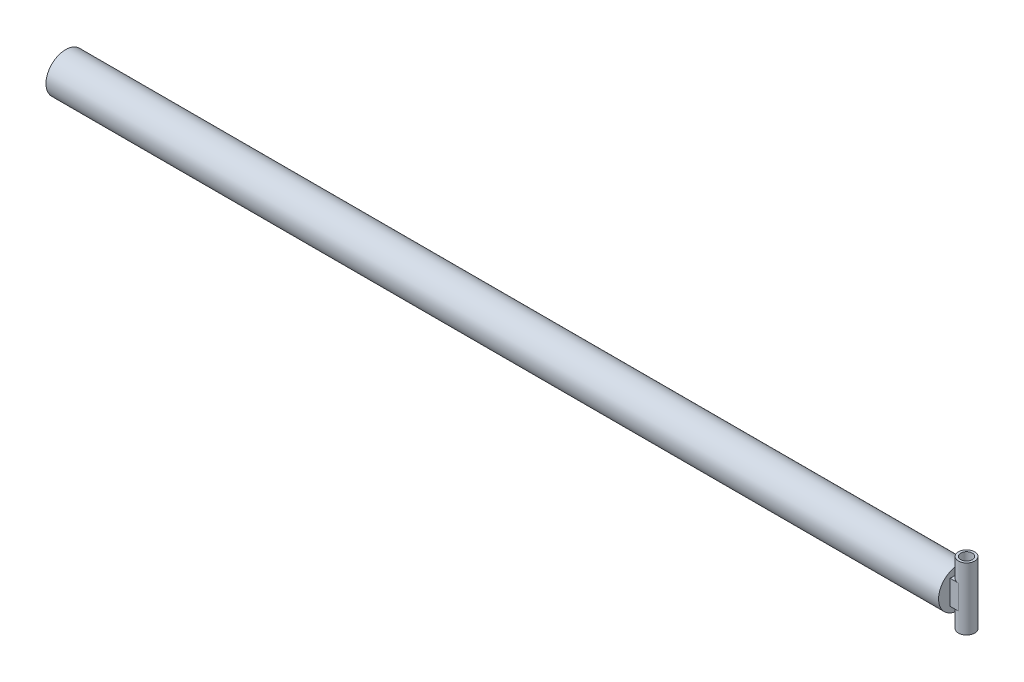
from build123d import *

# Parameters (mm, degrees)
CILINDAR_SHELL1_T                 = -10
CILINDAR_SKETCH3_W                = 30
CILINDAR_SKETCH3_H                = 10
CILINDAR_BOSS_EXTRUDE1_DEPTH      = 135
CILINDAR_BOSS_EXTRUDE1_DEPTH_BACK = 135
CILINDAR_SKETCH2_R                = 35
CILINDAR_SKETCH2_R_2              = 25
CILINDAR_BOSS_EXTRUDE7_REACH      = 3865.295
CILINDAR_SKETCH6_W                = 70
CILINDAR_SKETCH6_H                = 105
CILINDAR_SKETCH7_R                = 65
CILINDAR_SKETCH7_R_2              = 18.75
CILINDAR_BOSS_EXTRUDE8_DEPTH      = 10


with BuildPart() as part:
    # cilindar_Sketch1 → cilindar_Revolve1 (revolve)
    with BuildSketch(Plane(origin=(0, 0, 0), x_dir=(1, 0, 0), z_dir=(0, 1, 0))):
        Polygon((-1930, 75), (-1930, 0), (1930, 0), (1930, 75), (1900, 75), (1900, 85), (-1900, 85), (-1900, 75), align=None)
    revolve(axis=Axis((-1930, 0, 0), (1, 0, 0)))

    # cilindar_Shell1
    cilindar_shell1_openings = [part.faces().sort_by_distance(p)[0] for p in [
        (-1930, 0, 0),
    ]]
    offset(amount=CILINDAR_SHELL1_T, openings=cilindar_shell1_openings, kind=Kind.INTERSECTION)

    # cilindar_Sketch3 → cilindar_Revolve2 (revolve)
    with BuildSketch(Plane(origin=(0, 0, 0), x_dir=(1, 0, 0), z_dir=(0, 1, 0))):
        with Locations((-1915, 80)):
            Rectangle(CILINDAR_SKETCH3_W, CILINDAR_SKETCH3_H)
    cilindar_revolve2 = revolve(axis=Axis((1890, 0, 0), (-1, 0, 0)))

    # cilindar_Mirror2: cilindar_Revolve2 across plane
    add(cilindar_revolve2.mirror(Plane(origin=(0, 0, 0), x_dir=(0, 0, 1), z_dir=(1, 0, 0))))


with BuildPart() as body_2:
    # cilindar_Sketch2 → cilindar_Boss-Extrude1 (new, two sides: drawn at the far end of the back side and taken through both)
    with BuildSketch(Plane(origin=(0, 0, 0), x_dir=(1, 0, 0), z_dir=(0, 1, 0)).offset(-CILINDAR_BOSS_EXTRUDE1_DEPTH_BACK)):
        with Locations((1966, 0)):
            Circle(CILINDAR_SKETCH2_R)
        with Locations((1966, 0)):
            Circle(CILINDAR_SKETCH2_R_2, mode=Mode.SUBTRACT)
    extrude(amount=CILINDAR_BOSS_EXTRUDE1_DEPTH + CILINDAR_BOSS_EXTRUDE1_DEPTH_BACK)

    # cilindar_Sketch6 → cilindar_Boss-Extrude7 (add, up to next)
    with BuildSketch(Plane(origin=(1930, 0, 0), x_dir=(0, 0, -1), z_dir=(1, 0, 0)), mode=Mode.PRIVATE) as cilindar_boss_extrude7_sk1:
        Rectangle(CILINDAR_SKETCH6_W, CILINDAR_SKETCH6_H)
    cilindar_boss_extrude7_tool1 = extrude(cilindar_boss_extrude7_sk1.sketch, amount=CILINDAR_BOSS_EXTRUDE7_REACH, mode=Mode.PRIVATE) - body_2.part

    add(part.part)  # cilindar_Boss-Extrude7 merges part
    add(cilindar_boss_extrude7_tool1.solids().sort_by_distance((1930, 0, 0))[0])

    # cilindar_Sketch7 → cilindar_Boss-Extrude8 (add)
    with BuildSketch(Plane.ZY.offset(1930)):
        Circle(CILINDAR_SKETCH7_R)
        Circle(CILINDAR_SKETCH7_R_2, mode=Mode.SUBTRACT)
    extrude(amount=-CILINDAR_BOSS_EXTRUDE8_DEPTH)


solid = body_2.part
